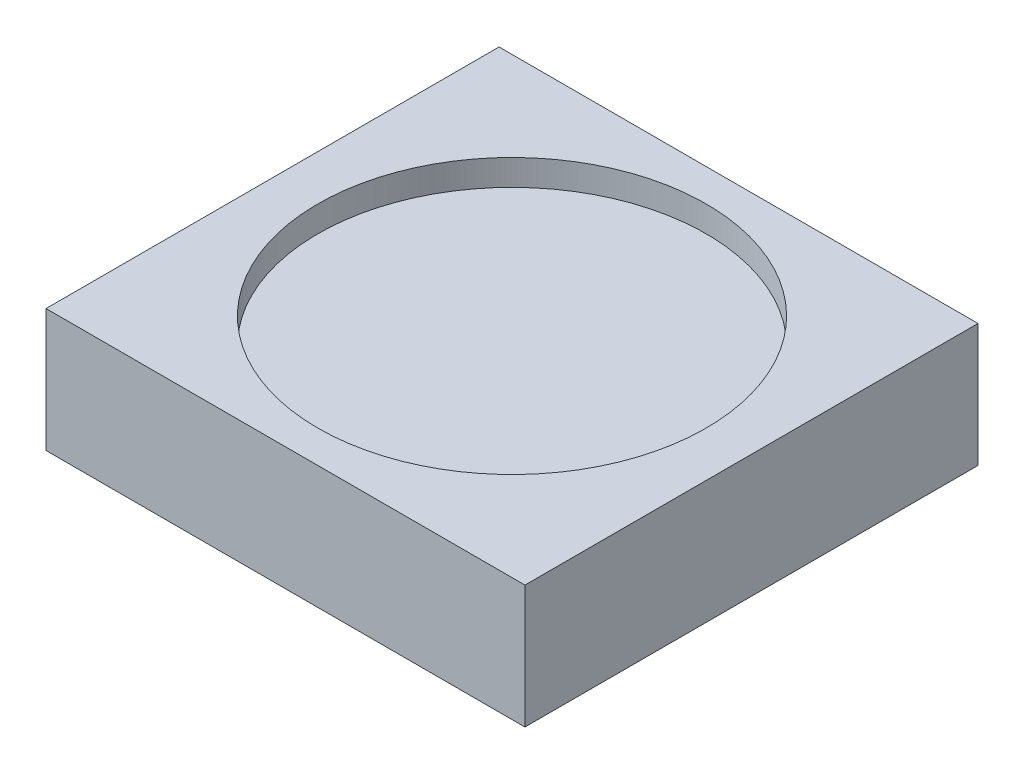
from build123d import *

# Parameters (mm, degrees)
SKETCH1_W           = 3.7
SKETCH1_H           = 3.5
BOSS_EXTRUDE1_DEPTH = 0.95
SKETCH2_R           = 1.5
CUT_EXTRUDE1_DEPTH  = 0.2


with BuildPart() as part:
    # Sketch1 → Boss-Extrude1 (new body)
    with BuildSketch(Plane(origin=(0, 0, 0), x_dir=(1, 0, 0), z_dir=(0, 1, 0))):
        with Locations((1.85, 1.75)):
            Rectangle(SKETCH1_W, SKETCH1_H)
    extrude(amount=BOSS_EXTRUDE1_DEPTH)

    # Sketch2 → Cut-Extrude1 (cut)
    with BuildSketch(Plane(origin=(0, 0.95, 0), x_dir=(1, 0, 0), z_dir=(0, 1, 0))):
        with Locations(Location((1.85, 1.75, 0), (0, 0, 270))):
            Circle(SKETCH2_R)
    extrude(amount=-CUT_EXTRUDE1_DEPTH, mode=Mode.SUBTRACT)


solid = part.part
